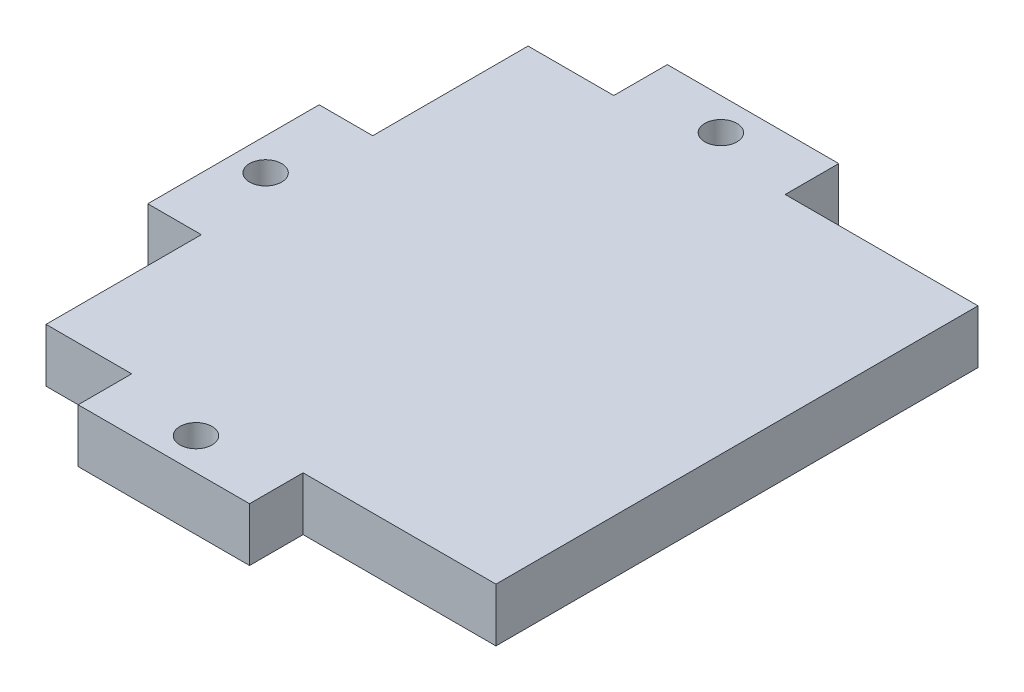
from build123d import *

# Parameters (mm, degrees)
CROQUIS1_W              = 32
CROQUIS1_H              = 45
SALIENTE_EXTRUIR1_DEPTH = 5
CROQUIS2_W              = 16
CROQUIS2_H              = 10
SALIENTE_EXTRUIR2_DEPTH = 5
CROQUIS3_R              = 1.5
CORTAR_EXTRUIR1_DEPTH   = 33.20636583
CROQUIS4_W              = 10
CROQUIS4_H              = 16
SALIENTE_EXTRUIR3_DEPTH = 5
CROQUIS5_R              = 1.5
CORTAR_EXTRUIR2_DEPTH   = 35.960692213
CROQUIS6_W              = 10
CROQUIS6_H              = 45
SALIENTE_EXTRUIR4_DEPTH = 5


with BuildPart() as part:
    # Croquis1 → Saliente-Extruir1 (new body)
    with BuildSketch(Plane(origin=(0, 0, 0), x_dir=(1, 0, 0), z_dir=(0, 1, 0))):
        Rectangle(CROQUIS1_W, CROQUIS1_H)
    extrude(amount=SALIENTE_EXTRUIR1_DEPTH)

    # Croquis2 → Saliente-Extruir2 (add, through all)
    with BuildSketch(Plane(origin=(0, 5, 0), x_dir=(1, 0, 0), z_dir=(0, 1, 0))):
        with Locations((0, 22.5)):
            Rectangle(CROQUIS2_W, CROQUIS2_H)
    saliente_extruir2 = extrude(amount=-SALIENTE_EXTRUIR2_DEPTH)

    # Croquis3 → Cortar-Extruir1 (cut, through all)
    with BuildSketch(Plane(origin=(0, 5, 0), x_dir=(1, 0, 0), z_dir=(0, 1, 0))):
        with Locations(Location((0, 24.5, 0), (0, 0, 270))):
            Circle(CROQUIS3_R)
    cortar_extruir1 = extrude(amount=-CORTAR_EXTRUIR1_DEPTH, mode=Mode.SUBTRACT)

    # Simetría1: Saliente-Extruir2, Cortar-Extruir1 across plane
    add(saliente_extruir2.mirror(Plane.XY))
    add(cortar_extruir1.mirror(Plane.XY), mode=Mode.SUBTRACT)

    # Croquis4 → Saliente-Extruir3 (add, through all)
    with BuildSketch(Plane(origin=(0, 5, 0), x_dir=(1, 0, 0), z_dir=(0, 1, 0))):
        with Locations((-16, 0)):
            Rectangle(CROQUIS4_W, CROQUIS4_H)
    extrude(amount=-SALIENTE_EXTRUIR3_DEPTH)

    # Croquis5 → Cortar-Extruir2 (cut, through all)
    with BuildSketch(Plane(origin=(0, 5, 0), x_dir=(1, 0, 0), z_dir=(0, 1, 0))):
        with Locations(Location((-18, 0, 0), (0, 0, 270))):
            Circle(CROQUIS5_R)
    extrude(amount=-CORTAR_EXTRUIR2_DEPTH, mode=Mode.SUBTRACT)

    # Croquis6 → Saliente-Extruir4 (add)
    with BuildSketch(Plane(origin=(0, 5, 0), x_dir=(1, 0, 0), z_dir=(0, 1, 0))):
        with Locations((21, 0)):
            Rectangle(CROQUIS6_W, CROQUIS6_H)
    extrude(amount=-SALIENTE_EXTRUIR4_DEPTH)


solid = part.part
